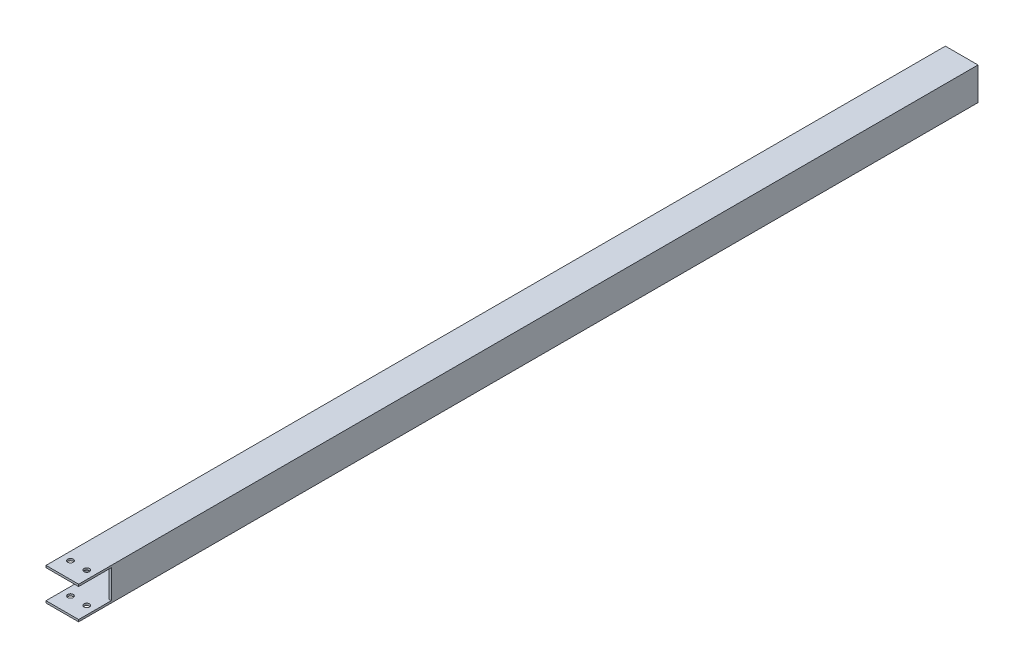
from build123d import *

# Parameters (mm, degrees)
ESQUISSE1_W             = 25.4
ESQUISSE1_H             = 25.4
ESQUISSE1_W_2           = 22.225
ESQUISSE1_H_2           = 22.225
BOSS_EXTRU_1_DEPTH      = 350
ESQUISSE2_R             = 2.159
ENL_V_MAT_EXTRU_1_DEPTH = 352.150181546
ESQUISSE3_W             = 25.4
ESQUISSE3_H             = 22.225
ENL_V_MAT_EXTRU_3_DEPTH = 352.150181546


with BuildPart() as part:
    # Esquisse1 → Boss.-Extru.1 (new, symmetric)
    with BuildSketch(Plane.XY):
        Rectangle(ESQUISSE1_W, ESQUISSE1_H)
        Rectangle(ESQUISSE1_W_2, ESQUISSE1_H_2, mode=Mode.SUBTRACT)
    extrude(amount=BOSS_EXTRU_1_DEPTH, both=True)

    # Esquisse2 → Enlèv. mat.-Extru.1 (cut, through all)
    with BuildSketch(Plane.XZ.offset(12.7)):
        with Locations((6.35, 337.3)):
            Circle(ESQUISSE2_R)
    enl_v_mat_extru_1 = extrude(amount=-ENL_V_MAT_EXTRU_1_DEPTH, mode=Mode.SUBTRACT)

    # Symétrie1: Enlèv. mat.-Extru.1 across plane
    add(enl_v_mat_extru_1.mirror(Plane(origin=(0, 0, 0), x_dir=(0, 0, 1), z_dir=(1, 0, 0))), mode=Mode.SUBTRACT)

    # Esquisse3 → Enlèv. mat.-Extru.3 (cut, through all)
    with BuildSketch(Plane(origin=(12.7, 0, 0), x_dir=(0, 0, -1), z_dir=(1, 0, 0))):
        with Locations((-337.3, 0)):
            Rectangle(ESQUISSE3_W, ESQUISSE3_H)
    extrude(amount=-ENL_V_MAT_EXTRU_3_DEPTH, mode=Mode.SUBTRACT)


solid = part.part
